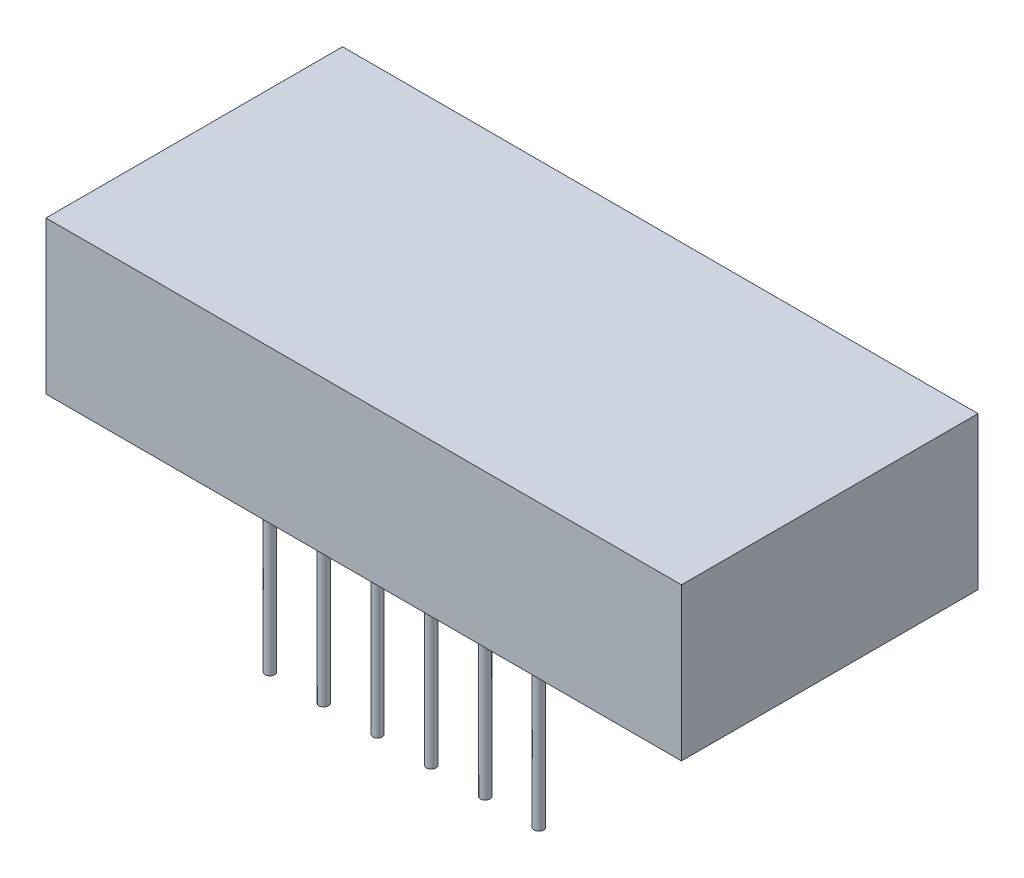
from build123d import *

# Parameters (mm, degrees)
SKETCH1_W           = 30
SKETCH1_H           = 14
BOSS_EXTRUDE1_DEPTH = 7.2
SKETCH2_R           = 0.225
BOSS_EXTRUDE2_DEPTH = 8


with BuildPart() as part:
    # Sketch1 → Boss-Extrude1 (new body)
    with BuildSketch(Plane(origin=(0, 0, 0), x_dir=(1, 0, 0), z_dir=(0, 1, 0))):
        Rectangle(SKETCH1_W, SKETCH1_H)
    extrude(amount=BOSS_EXTRUDE1_DEPTH)

    # Sketch2 → Boss-Extrude2 (add)
    with BuildSketch(Plane.XZ):
        with Locations(Location((-6.35, -5.08, 0), (0, 0, 270))):
            Circle(SKETCH2_R)
        with Locations(Location((-3.81, -5.08, 0), (0, 0, 270))):
            Circle(SKETCH2_R)
        with Locations(Location((-1.27, -5.08, 0), (0, 0, 270))):
            Circle(SKETCH2_R)
        with Locations(Location((1.27, -5.08, 0), (0, 0, 270))):
            Circle(SKETCH2_R)
        with Locations(Location((3.81, -5.08, 0), (0, 0, 270))):
            Circle(SKETCH2_R)
        with Locations(Location((6.35, -5.08, 0), (0, 0, 270))):
            Circle(SKETCH2_R)
        with Locations(Location((-3.81, 5.08, 0), (0, 0, 270))):
            Circle(SKETCH2_R)
        with Locations(Location((-1.27, 5.08, 0), (0, 0, 270))):
            Circle(SKETCH2_R)
        with Locations(Location((1.27, 5.08, 0), (0, 0, 270))):
            Circle(SKETCH2_R)
        with Locations(Location((3.81, 5.08, 0), (0, 0, 270))):
            Circle(SKETCH2_R)
        with Locations(Location((6.35, 5.08, 0), (0, 0, 270))):
            Circle(SKETCH2_R)
        with Locations(Location((-6.35, 5.08, 0), (0, 0, 270))):
            Circle(SKETCH2_R)
    extrude(amount=BOSS_EXTRUDE2_DEPTH)


solid = part.part
